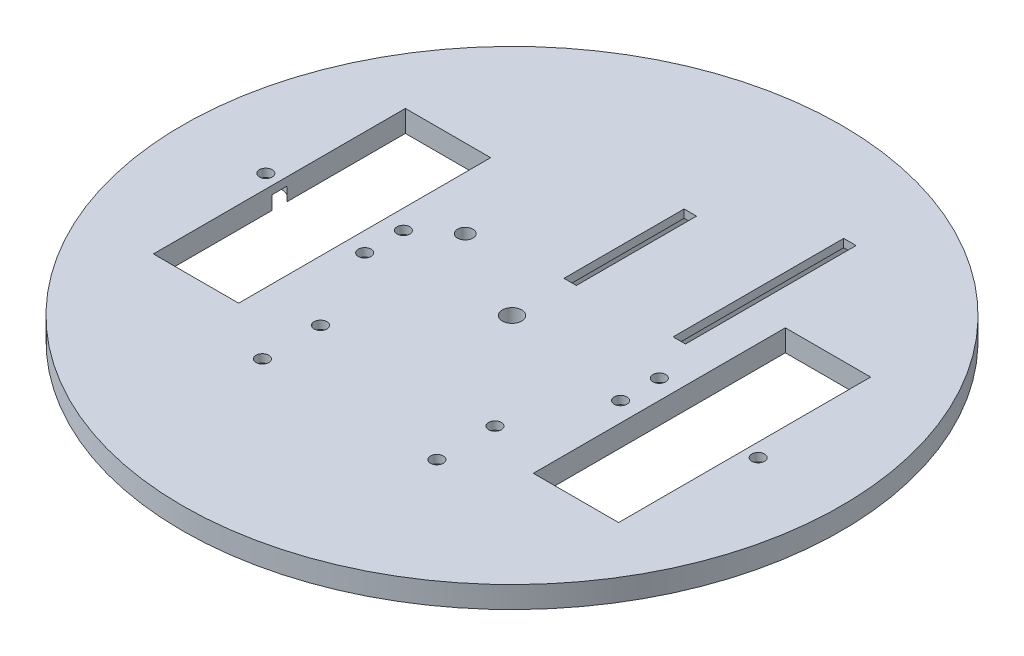
from build123d import *

# Parameters (mm, degrees)
SKETCH1_R                      = 85
SKETCH1_R_2                    = 2.5
SKETCH1_R_3                    = 2
SKETCH1_W                      = 22
SKETCH1_H                      = 65
BOSS_EXTRUDE1_DEPTH            = 5.588
CBORE_FOR_M3_SHCS1_D           = 3.3
CBORE_FOR_M3_SHCS1_CBORE_D     = 8
CBORE_FOR_M3_SHCS1_CBORE_DEPTH = 3.5
CBORE_FOR_M3_SHCS2_D           = 3.3
CBORE_FOR_M3_SHCS2_CBORE_D     = 8
CBORE_FOR_M3_SHCS2_CBORE_DEPTH = 3.5
SKETCH16_R                     = 1.65
CUT_EXTRUDE1_DEPTH             = 1
SKETCH17_W                     = 3.2
SKETCH17_H                     = 44
SKETCH17_H_2                   = 31
CUT_EXTRUDE2_DEPTH             = 121.337964683
SKETCH20_W                     = 6
SKETCH20_H                     = 50
SKETCH20_H_2                   = 37
CUT_EXTRUDE6_DEPTH             = 3.5


with BuildPart() as part:
    # Sketch1 → Boss-Extrude1 (new body)
    with BuildSketch(Plane(origin=(0, 0, 0), x_dir=(1, 0, 0), z_dir=(0, 1, 0))):
        with Locations(Location((0, 0, 0), (0, 0, 270))):
            Circle(SKETCH1_R)
        with Locations(Location((0, 0, 0), (0, 0, 270))):
            Circle(SKETCH1_R_2, mode=Mode.SUBTRACT)
        with Locations(Location((-24.317199098, 12.25, 0), (0, 0, 270))):
            Circle(SKETCH1_R_3, mode=Mode.SUBTRACT)
        with Locations((-49, 0)):
            Rectangle(SKETCH1_W, SKETCH1_H, mode=Mode.SUBTRACT)
        with Locations((49, 0)):
            Rectangle(SKETCH1_W, SKETCH1_H, mode=Mode.SUBTRACT)
    extrude(amount=BOSS_EXTRUDE1_DEPTH)

    # CBORE for M3 SHCS1 (through all)
    with Locations(Plane(origin=(0, 0, 0), x_dir=(-1, 0, 0), z_dir=(0, -1, 0))):
        with Locations((-33, 5), (-33, -5), (33, 5), (33, -5), (-63.5, 0), (63.5, 0)):
            CounterBoreHole(CBORE_FOR_M3_SHCS1_D / 2, CBORE_FOR_M3_SHCS1_CBORE_D / 2, CBORE_FOR_M3_SHCS1_CBORE_DEPTH)

    # CBORE for M3 SHCS2 (through all)
    with Locations(Plane(origin=(0, 0, 0), x_dir=(-1, 0, 0), z_dir=(0, -1, 0))):
        with Locations((22.5, -26.887097638), (-22.5, -26.887097638), (22.5, -41.887097638), (-22.5, -41.887097638)):
            CounterBoreHole(CBORE_FOR_M3_SHCS2_D / 2, CBORE_FOR_M3_SHCS2_CBORE_D / 2, CBORE_FOR_M3_SHCS2_CBORE_DEPTH)

    # Sketch16 → Cut-Extrude1 (cut)
    with BuildSketch(Plane.XZ):
        with Locations(Location((0, -65, 0), (0, 0, 270))):
            Circle(SKETCH16_R)
        with Locations(Location((0, 65, 0), (0, 0, 90))):
            Circle(SKETCH16_R)
    extrude(amount=-CUT_EXTRUDE1_DEPTH, mode=Mode.SUBTRACT)

    # Sketch17 → Cut-Extrude2 (cut, through all)
    with BuildSketch(Plane.XZ):
        with Locations((27.15, -38)):
            Rectangle(SKETCH17_W, SKETCH17_H)
        with Locations((0, -30.5)):
            Rectangle(SKETCH17_W, SKETCH17_H_2)
    extrude(amount=-CUT_EXTRUDE2_DEPTH, mode=Mode.SUBTRACT)

    # Sketch20 → Cut-Extrude6 (cut)
    with BuildSketch(Plane(origin=(0, 0, 0), x_dir=(-1, 0, 0), z_dir=(0, 1, 0))):
        with Locations((-27.15, -38)):
            Rectangle(SKETCH20_W, SKETCH20_H)
        with Locations((0, -30.5)):
            Rectangle(SKETCH20_W, SKETCH20_H_2)
    extrude(amount=CUT_EXTRUDE6_DEPTH, mode=Mode.SUBTRACT)


solid = part.part
